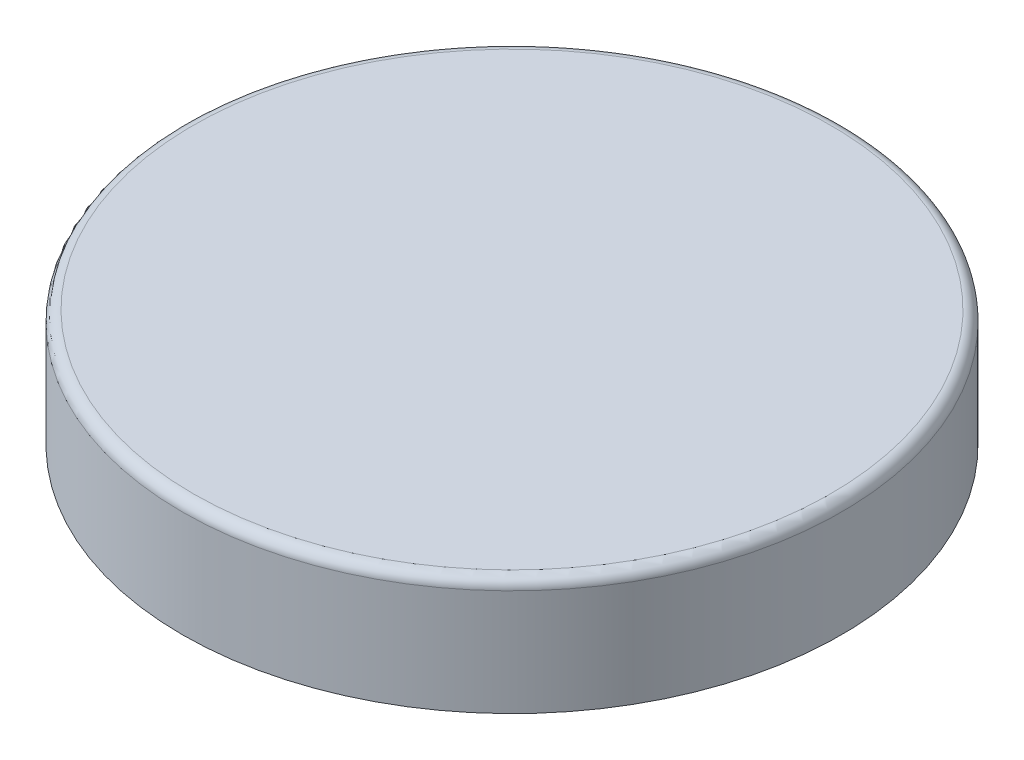
from build123d import *

# Parameters (mm, degrees)
SKETCH1_R           = 31
SKETCH1_R_2         = 30
BOSS_EXTRUDE1_DEPTH = 10
SKETCH2_R           = 31
BOSS_EXTRUDE2_DEPTH = 1
FILLET1_R           = 1


with BuildPart() as part:
    # Sketch1 → Boss-Extrude1 (new body)
    with BuildSketch(Plane(origin=(0, 0, 0), x_dir=(1, 0, 0), z_dir=(0, 1, 0))):
        with Locations(Location((0, 0, 0), (0, 0, 270))):
            Circle(SKETCH1_R)
        with Locations(Location((0, 0, 0), (0, 0, 270))):
            Circle(SKETCH1_R_2, mode=Mode.SUBTRACT)
    extrude(amount=BOSS_EXTRUDE1_DEPTH)

    # Sketch2 → Boss-Extrude2 (add)
    with BuildSketch(Plane(origin=(0, 10, 0), x_dir=(1, 0, 0), z_dir=(0, 1, 0))):
        with Locations(Location((0, 0, 0), (0, 0, 270))):
            Circle(SKETCH2_R)
    extrude(amount=BOSS_EXTRUDE2_DEPTH)

    # Fillet1
    fillet1_edges = [part.edges().sort_by_distance(p)[0] for p in [
        (0, 11, -31),
    ]]
    fillet(fillet1_edges, radius=FILLET1_R)


solid = part.part
